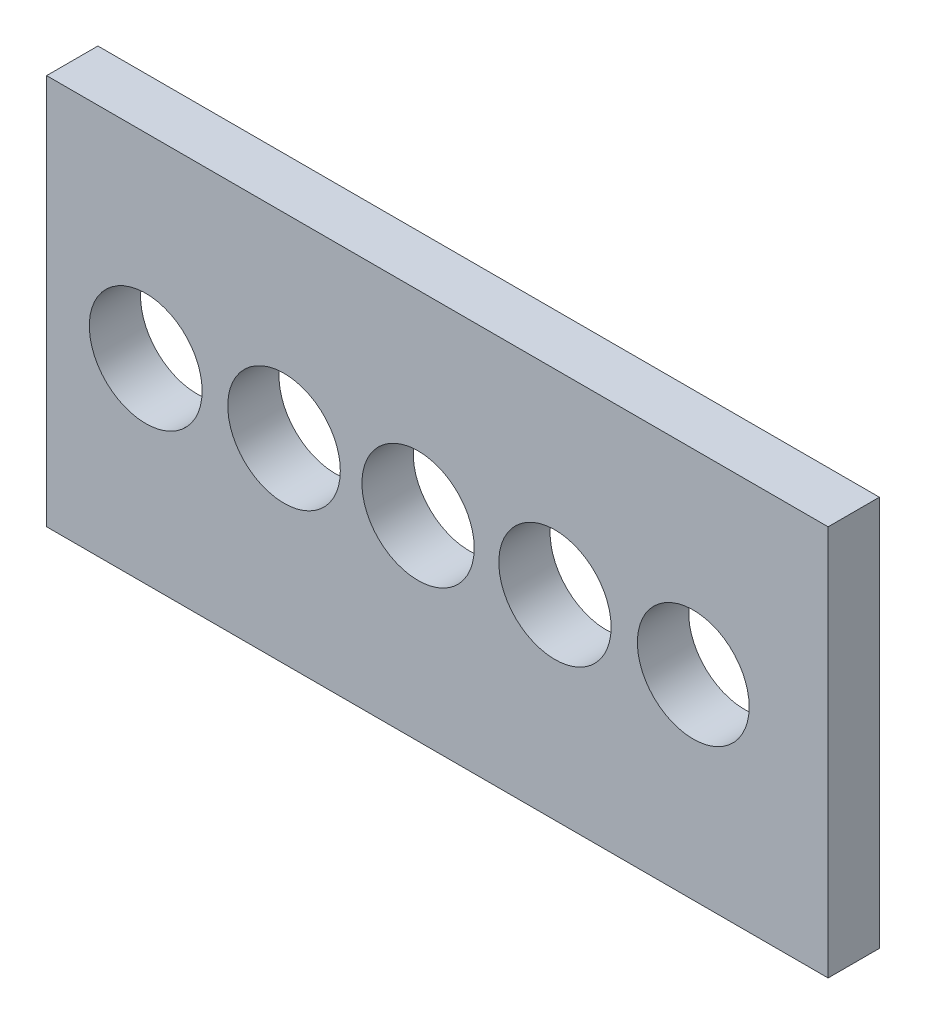
from build123d import *

# Parameters (mm, degrees)
SKETCH1_W           = 152.4
SKETCH1_H           = 76.2
SKETCH1_R           = 10.999999971
SKETCH1_R_2         = 10.975
SKETCH1_R_3         = 10.95
SKETCH1_R_4         = 10.9
BOSS_EXTRUDE1_DEPTH = 10


with BuildPart() as part:
    # Sketch1 → Boss-Extrude1 (new body)
    with BuildSketch(Plane.XY):
        with Locations((76.2, -38.1)):
            Rectangle(SKETCH1_W, SKETCH1_H)
        with Locations((19.32631179, -38.1)):
            Circle(SKETCH1_R, mode=Mode.SUBTRACT)
        with Locations((46.299725366, -38.1)):
            Circle(SKETCH1_R_2, mode=Mode.SUBTRACT)
        with Locations((72.438909657, -38.1)):
            Circle(SKETCH1_R_3, mode=Mode.SUBTRACT)
        with Locations((99.134246805, -38.1)):
            Circle(SKETCH1_R_3, mode=Mode.SUBTRACT)
        with Locations((126.107660382, -38.1)):
            Circle(SKETCH1_R_4, mode=Mode.SUBTRACT)
    extrude(amount=BOSS_EXTRUDE1_DEPTH)


solid = part.part
